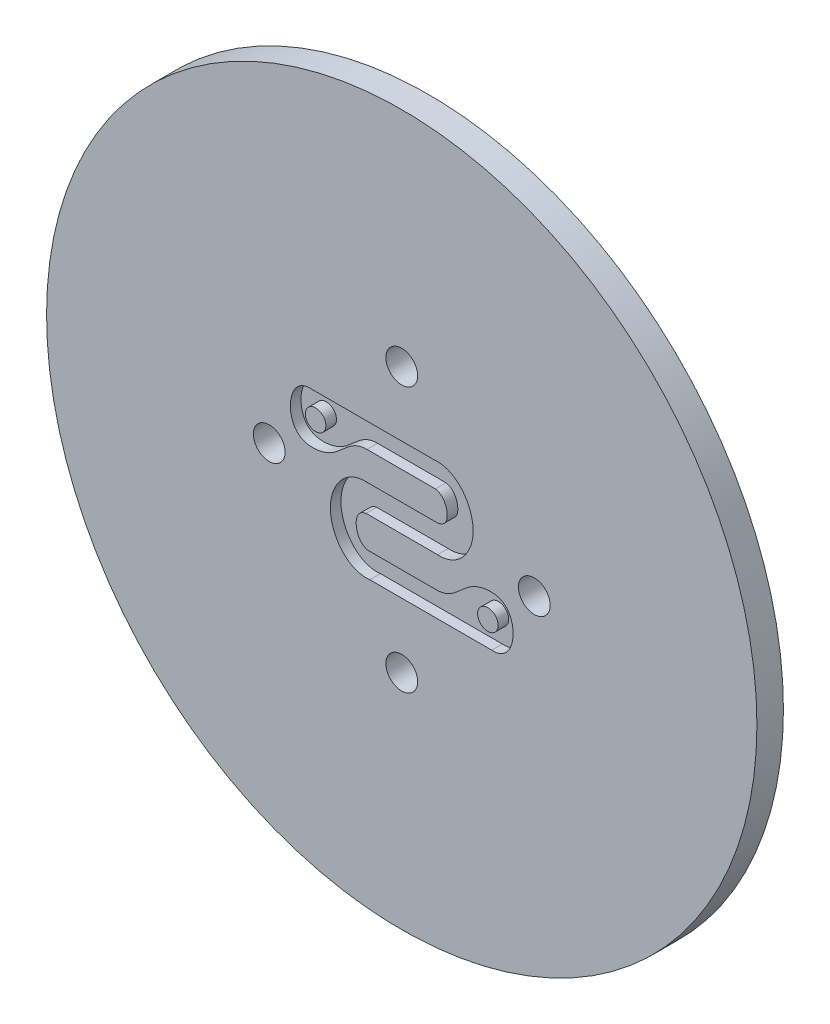
from build123d import *

# Parameters (mm, degrees)
SZKIC1_R                    = 67
SZKIC1_R_2                  = 3
DODANIE_WYCI_GNI_CIE1_DEPTH = 5
SZKIC2_R                    = 1.937371164
WYTNIJ_WYCI_GNI_CIE1_DEPTH  = 2


with BuildPart() as part:
    # Szkic1 → Dodanie-wyciągnięcie1 (new body)
    with BuildSketch(Plane.XY):
        Circle(SZKIC1_R)
        with Locations((0, 25)):
            Circle(SZKIC1_R_2, mode=Mode.SUBTRACT)
        with Locations((25, 0)):
            Circle(SZKIC1_R_2, mode=Mode.SUBTRACT)
        with Locations((0, -25)):
            Circle(SZKIC1_R_2, mode=Mode.SUBTRACT)
        with Locations((-25, 0)):
            Circle(SZKIC1_R_2, mode=Mode.SUBTRACT)
    extrude(amount=DODANIE_WYCI_GNI_CIE1_DEPTH)

    # Szkic2 → Wytnij-wyciągnięcie1 (cut)
    with BuildSketch(Plane.XY.offset(5)):
        with BuildLine():
            Line((6.015596419, 12.825090242), (-16.98777971, 12.825090242))
            add(Edge.make_bspline(
                [(-16.98777971, 12.825090242), (-21.398431669, 13.157388334), (-22.546113217, 2.558365481), (-11.828245601, 3.533872092), (-9.796666854, 8.186074774), (-6.590160082, 8.194882462)],
                knots=[0, 0, 0, 0, 0.432020753, 0.673133157, 1, 1, 1, 1], degree=3))
            Line((-6.590160082, 8.194882462), (6.347109239, 8.194882462))
            add(Edge.make_bspline(
                [(6.750985333, 2.833348247), (8.366457692, 3.074986228), (9.070388327, 5.597763216), (7.624972799, 7.999760841), (6.347109239, 8.194882462)],
                knots=[0, 0, 0, 0, 0.494793037, 1, 1, 1, 1], degree=3))
            Line((6.750985333, 2.833348247), (-6.742018824, 2.833348247))
            add(Edge.make_bspline(
                [(-6.015596419, -12.825090242), (-10.545778612, -13.3417132), (-16.414760064, -4.631679813), (-10.491978135, 2.966309296), (-6.742018824, 2.833348247)],
                knots=[0, 0, 0, 0, 0.544342745, 1, 1, 1, 1], degree=3))
            Line((-6.015596419, -12.825090242), (16.98777971, -12.825090242))
            add(Edge.make_bspline(
                [(16.98777971, -12.825090242), (21.398431669, -13.157388334), (22.546113217, -2.558365481), (11.828245601, -3.533872092), (9.796666854, -8.186074774), (6.590160082, -8.194882462)],
                knots=[0, 0, 0, 0, 0.432020753, 0.673133157, 1, 1, 1, 1], degree=3))
            Line((6.590160082, -8.194882462), (-6.347109239, -8.194882462))
            add(Edge.make_bspline(
                [(-6.742018824, -2.341525215), (-8.383912674, -2.639536282), (-9.106573397, -5.485782084), (-7.635691285, -7.991138773), (-6.347109239, -8.194882462)],
                knots=[0, 0, 0, 0, 0.526459521, 1, 1, 1, 1], degree=3))
            Line((-6.742018824, -2.341525215), (6.750985333, -2.341525215))
            add(Edge.make_bspline(
                [(6.015596419, 12.825090242), (10.510890039, 13.359942568), (16.495321184, 4.672671746), (10.416213029, -2.612973757), (6.750985333, -2.341525215)],
                knots=[0, 0, 0, 0, 0.552476507, 1, 1, 1, 1], degree=3))
        make_face()
        with Locations((-16.245257119, 8.194882462)):
            Circle(SZKIC2_R, mode=Mode.SUBTRACT)
        with Locations((16.245257119, -8.194882462)):
            Circle(SZKIC2_R, mode=Mode.SUBTRACT)
    extrude(amount=-WYTNIJ_WYCI_GNI_CIE1_DEPTH, mode=Mode.SUBTRACT)


solid = part.part
